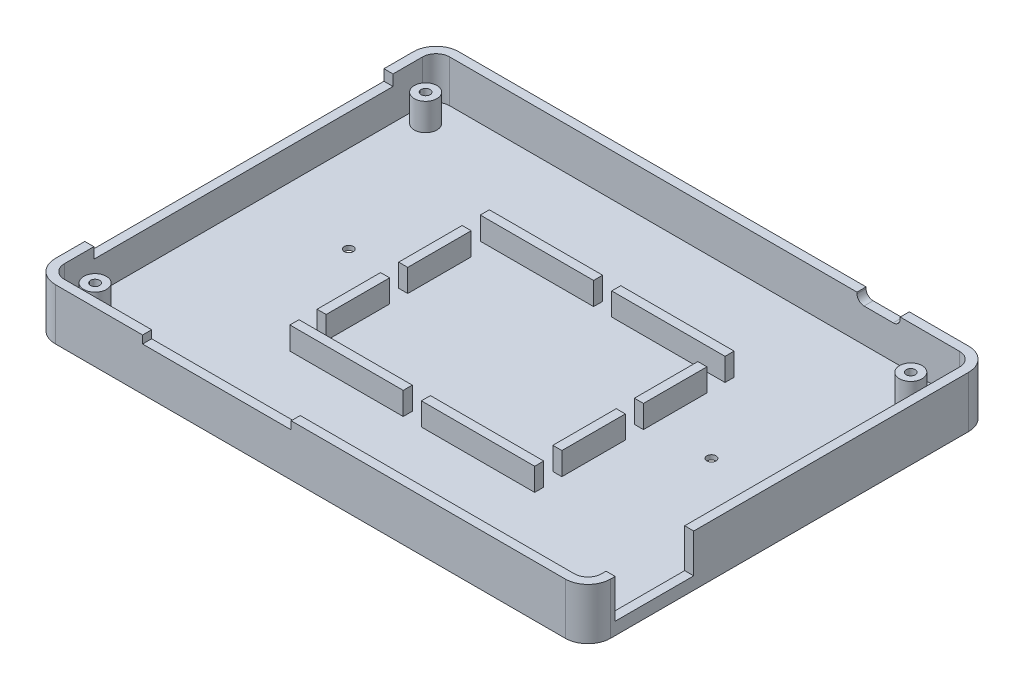
from build123d import *
from OCP.BRepFilletAPI import BRepFilletAPI_MakeFillet

# Parameters (mm, degrees)
SKETCH1_W           = 122.5
SKETCH1_H           = 89
BOSS_EXTRUDE1_DEPTH = 5.665
SHELL1_T            = -2
SKETCH2_R           = 2.5
SKETCH2_R_2         = 1
BOSS_EXTRUDE2_DEPTH = 6
FILLET1_R1          = 3
FILLET1_R2          = 5
SKETCH6_W           = 2
SKETCH6_H           = 66
CUT_EXTRUDE1_DEPTH  = 2.4
SKETCH7_W           = 2
SKETCH7_H           = 17.347336969
CUT_EXTRUDE2_DEPTH  = 8.57
CUT_EXTRUDE5_DEPTH  = 10
SKETCH13_W          = 32.782947734
SKETCH13_H          = 2.623502387
CUT_EXTRUDE6_DEPTH  = 10
SKETCH14_W          = 54
SKETCH14_H          = 44
SKETCH14_W_2        = 50
SKETCH14_H_2        = 40
BOSS_EXTRUDE3_DEPTH = 5
SKETCH15_W          = 2
SKETCH15_H          = 4
SKETCH15_W_2        = 4
SKETCH15_H_2        = 2
CUT_EXTRUDE7_DEPTH  = 5
CUT_EXTRUDE9_DEPTH  = 1
SKETCH17_R          = 1
CUT_EXTRUDE10_DEPTH = 1


with BuildPart() as part:
    # Sketch1 → Boss-Extrude1 (new, symmetric)
    with BuildSketch(Plane(origin=(0, 0, 0), x_dir=(1, 0, 0), z_dir=(0, 1, 0))):
        Rectangle(SKETCH1_W, SKETCH1_H)
    extrude(amount=BOSS_EXTRUDE1_DEPTH, both=True)

    # Shell1
    shell1_openings = [part.faces().sort_by_distance(p)[0] for p in [
        (0, 5.665, 0),
    ]]
    offset(amount=SHELL1_T, openings=shell1_openings, kind=Kind.INTERSECTION)

    # Sketch2 → Boss-Extrude2 (add)
    # profile 1 of 3: a face of its own
    with BuildSketch(Plane(origin=(0, -3.665, 0), x_dir=(1, 0, 0), z_dir=(0, 1, 0))):
        with Locations((-55.52, 36.46)):
            Circle(SKETCH2_R)
        with Locations((-55.52, 36.46)):
            Circle(SKETCH2_R_2, mode=Mode.SUBTRACT)
    # profile 2 of 3: a face of its own
    with BuildSketch(Plane(origin=(0, -3.665, 0), x_dir=(1, 0, 0), z_dir=(0, 1, 0))):
        with Locations((51.52, 36.46)):
            Circle(SKETCH2_R)
        with Locations((51.52, 36.46)):
            Circle(SKETCH2_R_2, mode=Mode.SUBTRACT)
    # profile 3 of 3: a face of its own
    with BuildSketch(Plane(origin=(0, -3.665, 0), x_dir=(1, 0, 0), z_dir=(0, 1, 0))):
        with Locations((-55.52, -36.46)):
            Circle(SKETCH2_R)
        with Locations((-55.52, -36.46)):
            Circle(SKETCH2_R_2, mode=Mode.SUBTRACT)
    extrude(amount=BOSS_EXTRUDE2_DEPTH)

    # Fillet1: one fillet with a radius per group of edges: ONE call of the kernel's fillet builder (fillet() takes one radius for all edges)
    fillet1_edges_1 = [part.edges().sort_by_distance(p)[0] for p in [
        (-59.25, 1, -42.5),
        (59.25, 1, -42.5),
        (59.25, 1, 42.5),
        (-59.25, 1, 42.5),
    ]]
    fillet1_edges_2 = [part.edges().sort_by_distance(p)[0] for p in [
        (-61.25, 0, -44.5),
        (61.25, 0, -44.5),
        (61.25, 0, 44.5),
        (-61.25, 0, 44.5),
    ]]
    fillet1 = BRepFilletAPI_MakeFillet(part.part.solid().wrapped)
    for e in fillet1_edges_1:
        fillet1.Add(FILLET1_R1, e.wrapped)
    for e in fillet1_edges_2:
        fillet1.Add(FILLET1_R2, e.wrapped)
    add(Compound.cast(fillet1.Shape()), mode=Mode.REPLACE)

    # Sketch6 → Cut-Extrude1 (cut)
    with BuildSketch(Plane(origin=(0, 5.665, 0), x_dir=(1, 0, 0), z_dir=(0, 1, 0))):
        with Locations((-60.25, 0)):
            Rectangle(SKETCH6_W, SKETCH6_H)
    extrude(amount=-CUT_EXTRUDE1_DEPTH, mode=Mode.SUBTRACT)

    # Sketch7 → Cut-Extrude2 (cut)
    with BuildSketch(Plane(origin=(0, 5.665, 0), x_dir=(1, 0, 0), z_dir=(0, 1, 0))):
        with Locations((60.25, -29.826331516)):
            Rectangle(SKETCH7_W, SKETCH7_H)
    extrude(amount=-CUT_EXTRUDE2_DEPTH, mode=Mode.SUBTRACT)

    # Sketch12 → Cut-Extrude5 (cut)
    with BuildSketch(Plane(origin=(0, 0, -44.5), x_dir=(-1, 0, 0), z_dir=(0, 0, -1))):
        with BuildLine():
            Line((-42.852887486, 5.665199886), (-33.912887486, 5.665199886))
            Line((-33.912887486, 5.665199886), (-33.612887486, 5.665))
            Line((-33.612887486, 5.665), (-33.612887486, 5.335199886))
            add(Edge.make_bspline(
                [(-35.162887486, 3.785199886), (-34.969276417, 3.785199886), (-34.590674628, 3.851796456), (-34.032768291, 4.205080692), (-33.679484056, 4.762987029), (-33.612887486, 5.141588818), (-33.612887486, 5.335199886)],
                knots=[0, 0, 0, 0, 0.25, 0.5, 0.75, 1, 1, 1, 1], degree=3))
            Line((-35.162887486, 3.785199886), (-41.602887486, 3.785199886))
            add(Edge.make_bspline(
                [(-43.152887486, 5.335199886), (-43.152887486, 5.141588818), (-43.086290916, 4.762987029), (-42.73300668, 4.205080692), (-42.175100343, 3.851796456), (-41.796498554, 3.785199886), (-41.602887486, 3.785199886)],
                knots=[0, 0, 0, 0, 0.25, 0.5, 0.75, 1, 1, 1, 1], degree=3))
            Line((-43.152887486, 5.335199886), (-43.152887486, 5.665))
            Line((-43.152887486, 5.665), (-42.852887486, 5.665199886))
        make_face()
    extrude(amount=-CUT_EXTRUDE5_DEPTH, mode=Mode.SUBTRACT)

    # Sketch13 → Cut-Extrude6 (cut)
    with BuildSketch(Plane.XY.offset(44.5)):
        with Locations((-20.613592251, 5.246951194)):
            Rectangle(SKETCH13_W, SKETCH13_H)
    extrude(amount=-CUT_EXTRUDE6_DEPTH, mode=Mode.SUBTRACT)

    # Sketch14 → Boss-Extrude3 (add)
    with BuildSketch(Plane(origin=(0, -3.665, 0), x_dir=(1, 0, 0), z_dir=(0, 1, 0))):
        Rectangle(SKETCH14_W, SKETCH14_H)
        Rectangle(SKETCH14_W_2, SKETCH14_H_2, mode=Mode.SUBTRACT)
    extrude(amount=BOSS_EXTRUDE3_DEPTH)

    # Sketch15 → Cut-Extrude7 (cut)
    with BuildSketch(Plane(origin=(0, 1.335, 0), x_dir=(1, 0, 0), z_dir=(0, 1, 0))):
        with Locations((-26, 18)):
            Rectangle(SKETCH15_W, SKETCH15_H)
        with Locations((-26, 0)):
            Rectangle(SKETCH15_W, SKETCH15_H)
        with Locations((-26, -18)):
            Rectangle(SKETCH15_W, SKETCH15_H)
        with Locations((26, -18)):
            Rectangle(SKETCH15_W, SKETCH15_H)
        with Locations((26, 0)):
            Rectangle(SKETCH15_W, SKETCH15_H)
        with Locations((26, 18)):
            Rectangle(SKETCH15_W, SKETCH15_H)
        with Locations((0, 21)):
            Rectangle(SKETCH15_W_2, SKETCH15_H_2)
        with Locations((0, -21)):
            Rectangle(SKETCH15_W_2, SKETCH15_H_2)
    extrude(amount=-CUT_EXTRUDE7_DEPTH, mode=Mode.SUBTRACT)

    # Sketch16 → Cut-Extrude9 (cut)
    with BuildSketch(Plane.XZ.offset(5.665)):
        with BuildLine():
            ThreePointArc((37.917995747, -2.616071429), (40, -6.5), (42.082004253, -2.616071429))
            ThreePointArc((42.082004253, -2.616071429), (41.931122098, -1.882594271), (42.331844763, -1.25))
            ThreePointArc((42.331844763, -1.25), (40, 6), (37.668155237, -1.25))
            ThreePointArc((37.668155237, -1.25), (38.068877902, -1.882594271), (37.917995747, -2.616071429))
        make_face()
        with BuildLine():
            ThreePointArc((-42.082004253, -2.616071429), (-40, -6.5), (-37.917995747, -2.616071429))
            ThreePointArc((-37.917995747, -2.616071429), (-38.068877902, -1.882594271), (-37.668155237, -1.25))
            ThreePointArc((-37.668155237, -1.25), (-40, 6), (-42.331844763, -1.25))
            ThreePointArc((-42.331844763, -1.25), (-41.931122098, -1.882594271), (-42.082004253, -2.616071429))
        make_face()
    extrude(amount=-CUT_EXTRUDE9_DEPTH, mode=Mode.SUBTRACT)

    # Sketch17 → Cut-Extrude10 (cut)
    with BuildSketch(Plane.XZ.offset(4.665)):
        with Locations((-40, -4)):
            Circle(SKETCH17_R)
        with Locations((40, -4)):
            Circle(SKETCH17_R)
    extrude(amount=-CUT_EXTRUDE10_DEPTH, mode=Mode.SUBTRACT)


solid = part.part
